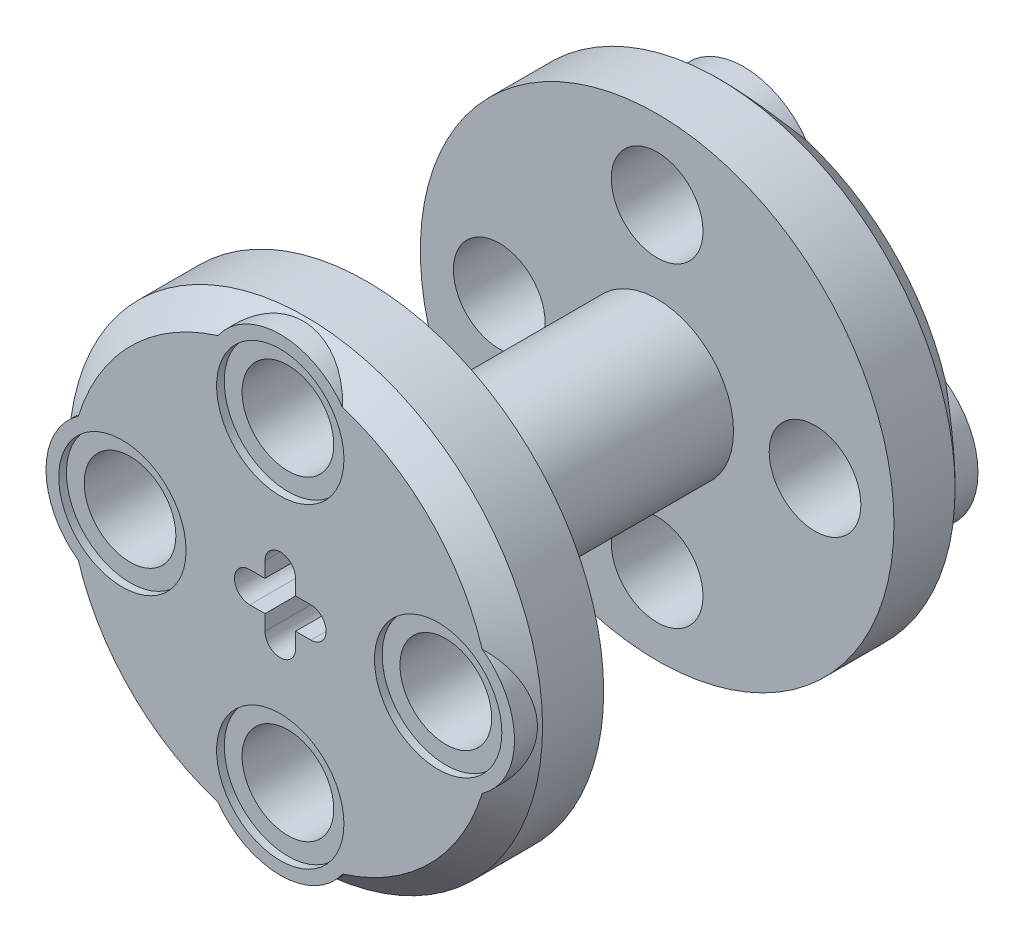
from build123d import *

# Parameters (mm, degrees)
SKETCH1_R           = 11.811
SKETCH1_R_2         = 2.286
EXTRUDE1_DEPTH      = 4.318
CHAMFER1_SIZE       = 1.27
EXTRUDE2_START      = -4.318
SKETCH2_R           = 2.794
SKETCH2_R_2         = 2.306678084
SKETCH2_R_3         = 2.286
SKETCH2_R_4         = 2.290860138
EXTRUDE2_DEPTH      = 4.318
SKETCH3_R           = 3.81
EXTRUDE3_DEPTH      = 7.239
SKETCH4_W           = 1.524
SKETCH4_H           = 1.524
CUT_EXTRUDE1_DEPTH  = 21.311664031
SKETCH5_R           = 3.81
SKETCH5_R_2         = 2.286
BOSS_EXTRUDE3_DEPTH = 4.318
BOSS_EXTRUDE5_START = -4.318
SKETCH6_R           = 3.81
SKETCH6_R_2         = 2.286
BOSS_EXTRUDE5_DEPTH = 4.318
SKETCH5_3_R         = 3.175
CUT_EXTRUDE2_DEPTH  = 0.381
CUT_EXTRUDE3_START  = -0.381
SKETCH6_3_R         = 3.175
CUT_EXTRUDE3_DEPTH  = 0.381
CIRPATTERN1_COUNT   = 4


with BuildPart() as part:
    # Sketch1 → Extrude1 (new body)
    with BuildSketch(Plane.XY):
        Circle(SKETCH1_R)
        with Locations((0, 7.874)):
            Circle(SKETCH1_R_2, mode=Mode.SUBTRACT)
        with Locations((7.874, 0)):
            Circle(SKETCH1_R_2, mode=Mode.SUBTRACT)
        with Locations((0, -7.874)):
            Circle(SKETCH1_R_2, mode=Mode.SUBTRACT)
        with Locations((-7.874, 0)):
            Circle(SKETCH1_R_2, mode=Mode.SUBTRACT)
    extrude(amount=EXTRUDE1_DEPTH)

    # Chamfer1
    chamfer1_edges = [part.edges().sort_by_distance(p)[0] for p in [
        (-11.811, 0, 4.318),
    ]]
    chamfer(chamfer1_edges, length=CHAMFER1_SIZE)

    # Sketch2 → Extrude2 (add)
    # profile 1 of 4: a face of its own
    with BuildSketch(Plane.XY.offset(4.318).offset(EXTRUDE2_START)):
        with Locations((0, 7.874)):
            Circle(SKETCH2_R)
        with Locations((0, 7.874)):
            Circle(SKETCH2_R_2, mode=Mode.SUBTRACT)
    # profile 2 of 4: a face of its own
    with BuildSketch(Plane.XY.offset(4.318).offset(EXTRUDE2_START)):
        with Locations((-7.874, 0)):
            Circle(SKETCH2_R)
        with Locations((-7.874, 0)):
            Circle(SKETCH2_R_3, mode=Mode.SUBTRACT)
    # profile 3 of 4: a face of its own
    with BuildSketch(Plane.XY.offset(4.318).offset(EXTRUDE2_START)):
        with Locations((0, -7.874)):
            Circle(SKETCH2_R)
        with Locations((0, -7.874)):
            Circle(SKETCH2_R_4, mode=Mode.SUBTRACT)
    # profile 4 of 4: a face of its own
    with BuildSketch(Plane.XY.offset(4.318).offset(EXTRUDE2_START)):
        with Locations((7.874, 0)):
            Circle(SKETCH2_R)
        with Locations((7.874, 0)):
            Circle(SKETCH2_R_3, mode=Mode.SUBTRACT)
    extrude(amount=EXTRUDE2_DEPTH)

    # Sketch3 → Extrude3 (add)
    with BuildSketch(Plane(origin=(0, 0, 0), x_dir=(-1, 0, 0), z_dir=(0, 0, -1))):
        with Locations(Location((0, 0, 0), (0, 0, 180))):
            Circle(SKETCH3_R)
    extrude(amount=EXTRUDE3_DEPTH)

    # Sketch4 → Cut-Extrude1 (cut, through all)
    with BuildSketch(Plane.XY.offset(4.318)):
        with BuildLine():
            Line((-0.762, 0.762), (-1.524, 0.762))
            ThreePointArc((-1.524, 0.762), (-2.286, 0), (-1.524, -0.762))
            Line((-1.524, -0.762), (-0.762, -0.762))
            Line((-0.762, -0.762), (-0.762, 0.762))
        make_face()
        with BuildLine():
            Line((-0.762, 1.524), (-0.762, 0.762))
            Line((-0.762, 0.762), (0.762, 0.762))
            Line((0.762, 0.762), (0.762, 1.524))
            ThreePointArc((0.762, 1.524), (0, 2.286), (-0.762, 1.524))
        make_face()
        with BuildLine():
            Line((1.524, 0.762), (0.762, 0.762))
            Line((0.762, 0.762), (0.762, -0.762))
            Line((0.762, -0.762), (1.524, -0.762))
            ThreePointArc((1.524, -0.762), (2.286, 0), (1.524, 0.762))
        make_face()
        Rectangle(SKETCH4_W, SKETCH4_H)
        with BuildLine():
            Line((0.762, -0.762), (-0.762, -0.762))
            Line((-0.762, -0.762), (-0.762, -1.524))
            ThreePointArc((-0.762, -1.524), (0, -2.286), (0.762, -1.524))
            Line((0.762, -1.524), (0.762, -0.762))
        make_face()
    extrude(amount=-CUT_EXTRUDE1_DEPTH, mode=Mode.SUBTRACT)

    # Mirror1: part across plane


with BuildPart() as part_1:
    add(part.part)
    add(part.part.mirror(Plane.XY.offset(-7.239)))

    # Sketch5 → Boss-Extrude3 (add)
    with BuildSketch(Plane.XY.offset(4.318)):
        with Locations((0, 7.874)):
            Circle(SKETCH5_R)
        with Locations((0, 7.874)):
            Circle(SKETCH5_R_2, mode=Mode.SUBTRACT)
    boss_extrude3 = extrude(amount=-BOSS_EXTRUDE3_DEPTH)

    # Sketch6 → Boss-Extrude5 (add)
    with BuildSketch(Plane(origin=(0, 0, -18.796), x_dir=(-1, 0, 0), z_dir=(0, 0, -1)).offset(BOSS_EXTRUDE5_START)):
        with Locations((0, 7.874)):
            Circle(SKETCH6_R)
        with Locations(Location((0, 7.874, 0), (0, 0, 180))):
            Circle(SKETCH6_R_2, mode=Mode.SUBTRACT)
    boss_extrude5 = extrude(amount=BOSS_EXTRUDE5_DEPTH)

    # Sketch5<3> → Cut-Extrude2 (cut)
    with BuildSketch(Plane.XY.offset(4.318)):
        with Locations((0, 7.874)):
            Circle(SKETCH5_3_R)
    cut_extrude2 = extrude(amount=-CUT_EXTRUDE2_DEPTH, mode=Mode.SUBTRACT)

    # Sketch6<3> → Cut-Extrude3 (cut)
    with BuildSketch(Plane(origin=(0, 0, -18.796), x_dir=(-1, 0, 0), z_dir=(0, 0, -1)).offset(CUT_EXTRUDE3_START)):
        with Locations(Location((0, 7.874, 0), (0, 0, 180))):
            Circle(SKETCH6_3_R)
    cut_extrude3 = extrude(amount=CUT_EXTRUDE3_DEPTH, mode=Mode.SUBTRACT)

    # CirPattern1: Boss-Extrude3, Boss-Extrude5, Cut-Extrude2, Cut-Extrude3 ×4 about axis
    cirpattern1_axis = Axis((0, 0, 0), (0, 0, 1))
    add([boss_extrude3.rotate(cirpattern1_axis, i * 360 / CIRPATTERN1_COUNT) for i in range(1, CIRPATTERN1_COUNT)])
    add([boss_extrude5.rotate(cirpattern1_axis, i * 360 / CIRPATTERN1_COUNT) for i in range(1, CIRPATTERN1_COUNT)])
    add([cut_extrude2.rotate(cirpattern1_axis, i * 360 / CIRPATTERN1_COUNT) for i in range(1, CIRPATTERN1_COUNT)], mode=Mode.SUBTRACT)
    add([cut_extrude3.rotate(cirpattern1_axis, i * 360 / CIRPATTERN1_COUNT) for i in range(1, CIRPATTERN1_COUNT)], mode=Mode.SUBTRACT)


solid = part_1.part
